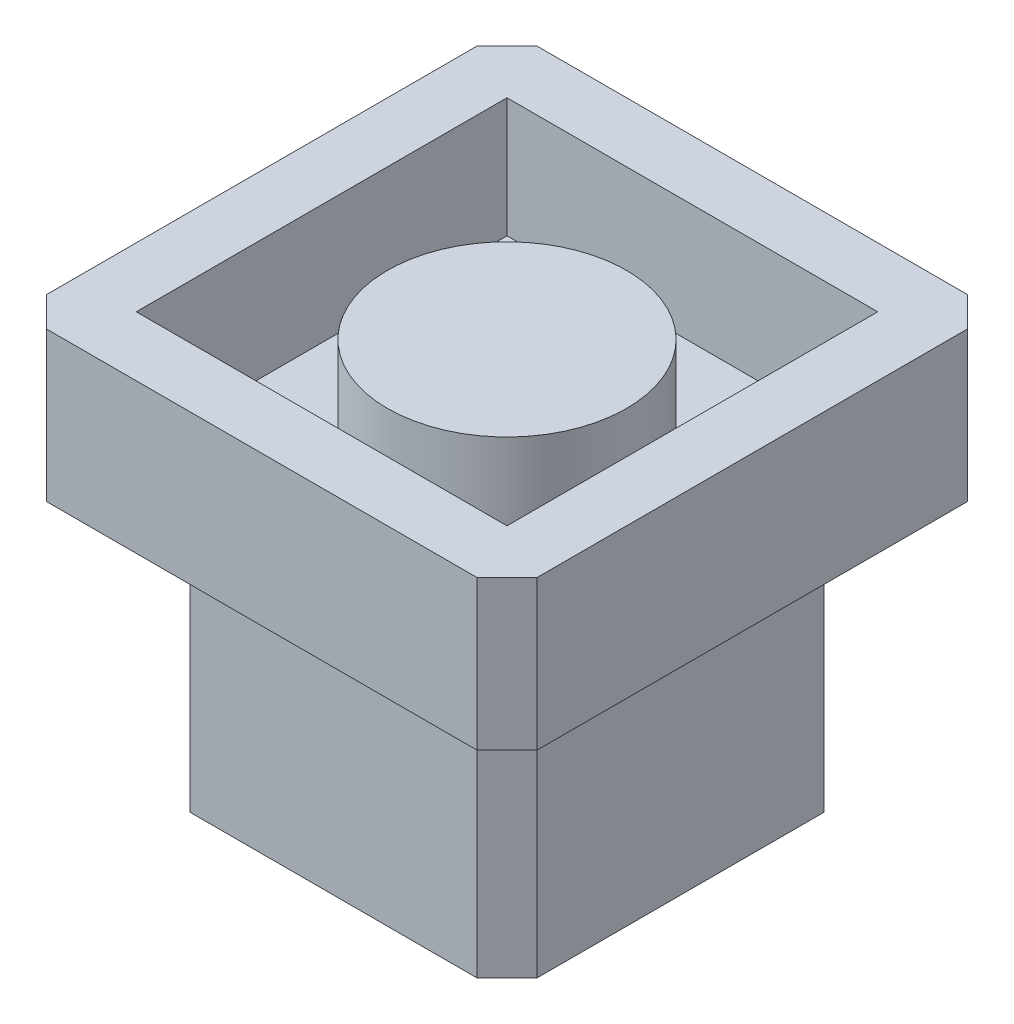
from build123d import *

# Parameters (mm, degrees)
SKETCH1_R           = 2
BOSS_EXTRUDE1_DEPTH = 1.6
SKETCH1_3_W         = 8.2
SKETCH1_3_H         = 8.2
SKETCH1_3_W_2       = 6.2
SKETCH1_3_H_2       = 6.2
BOSS_EXTRUDE2_DEPTH = 2
SKETCH1_4_W         = 8.2
SKETCH1_4_H         = 8.2
BOSS_EXTRUDE3_DEPTH = 0.5
SKETCH3_W           = 5.8
SKETCH3_H           = 5.8
BOSS_EXTRUDE4_DEPTH = 4.5
CHAMFER1_SIZE       = 0.5
CUT_EXTRUDE1_DEPTH  = 0.2


with BuildPart() as part:
    # Sketch1 → Boss-Extrude1 (new body)
    with BuildSketch(Plane(origin=(0, 0, 0), x_dir=(1, 0, 0), z_dir=(0, 1, 0))):
        Circle(SKETCH1_R)
    extrude(amount=BOSS_EXTRUDE1_DEPTH)



with BuildPart() as body_2:
    # Sketch1<3> → Boss-Extrude2 (new body)
    with BuildSketch(Plane(origin=(0, 0, 0), x_dir=(1, 0, 0), z_dir=(0, 1, 0))):
        Rectangle(SKETCH1_3_W, SKETCH1_3_H)
        Rectangle(SKETCH1_3_W_2, SKETCH1_3_H_2, mode=Mode.SUBTRACT)
    extrude(amount=BOSS_EXTRUDE2_DEPTH)


with BuildPart() as part_1:
    add(part.part)

    add(body_2.part)  # Boss-Extrude3 merges body 2
    # Sketch1<4> → Boss-Extrude3 (add)
    with BuildSketch(Plane(origin=(0, 0, 0), x_dir=(1, 0, 0), z_dir=(0, 1, 0))):
        Rectangle(SKETCH1_4_W, SKETCH1_4_H)
    extrude(amount=-BOSS_EXTRUDE3_DEPTH)

    # Sketch3 → Boss-Extrude4 (add)
    with BuildSketch(Plane.XZ.offset(0.5)):
        Rectangle(SKETCH3_W, SKETCH3_H)
    extrude(amount=BOSS_EXTRUDE4_DEPTH)

    # Chamfer1
    chamfer1_edges = [part_1.edges().sort_by_distance(p)[0] for p in [
        (-4.1, 0.75, -4.1),
        (4.1, 0.75, -4.1),
        (-4.1, 0.75, 4.1),
        (4.1, 0.75, 4.1),
        (-2.9, -2.75, 2.9),
        (2.9, -2.75, 2.9),
        (-2.9, -2.75, -2.9),
        (2.9, -2.75, -2.9),
    ]]
    chamfer(chamfer1_edges, length=CHAMFER1_SIZE)

    # Sketch4 → Cut-Extrude1 (cut)
    with BuildSketch(Plane.XZ.offset(5)):
        with BuildLine():
            Line((-0.866374082, 1.850562538), (-0.165953409, 1.850562538))
            add(Edge.make_bspline(
                [(-0.165953409, 1.850562538), (-0.11921228, 1.850406952), (-0.029464136, 1.85010821), (0.099109135, 1.848442447), (0.215936232, 1.843668091), (0.320956071, 1.839559508), (0.414166726, 1.832067567), (0.495854017, 1.824906919), (0.565641714, 1.815533259), (0.607887566, 1.806827836), (0.627015341, 1.802886256)],
                knots=[0, 0, 0, 0, 1.410062039, 2.707475311, 3.878576406, 4.937260626, 5.877586885, 6.699081471, 7.410979367, 8, 8, 8, 8], degree=3))
            add(Edge.make_bspline(
                [(0.627015341, 1.802886256), (0.652621966, 1.796559491), (0.703288955, 1.784040927), (0.776239021, 1.757581326), (0.845753345, 1.726961702), (0.911543169, 1.690997981), (0.973278961, 1.649423202), (1.031597271, 1.602955079), (1.086762735, 1.551847874), (1.136544365, 1.494813032), (1.183483417, 1.434976522), (1.223072043, 1.370272766), (1.257198523, 1.302611238), (1.28436904, 1.23130382), (1.306247013, 1.157042048), (1.321673253, 1.079153252), (1.33092444, 0.997992277), (1.331866296, 0.942634368), (1.332343867, 0.914564942)],
                knots=[0, 0, 0, 0, 1.027469482, 2.033020251, 3.019912614, 3.986113645, 4.951240523, 5.91722682, 6.890402269, 7.87763091, 8.8651537, 9.85103654, 10.82876324, 11.815024772, 12.821070561, 13.842952187, 14.906261191, 16, 16, 16, 16], degree=3))
            add(Edge.make_bspline(
                [(1.332343867, 0.914564942), (1.330874869, 0.867929837), (1.328008473, 0.77693267), (1.30128337, 0.644871788), (1.25750685, 0.521682474), (1.197183561, 0.407519836), (1.120364085, 0.30460919), (1.028039294, 0.214218735), (0.920157682, 0.138578822), (0.819728367, 0.086126018), (0.731014167, 0.052533109), (0.657980854, 0.02889675), (0.578313877, 0.010634785), (0.492776542, -0.005725347), (0.401012886, -0.018077041), (0.303242847, -0.027123636), (0.199396695, -0.032777684), (0.128057626, -0.033619689), (0.09135829, -0.034052846)],
                knots=[0, 0, 0, 0, 1.260483769, 2.459530307, 3.627416485, 4.787058657, 5.939039949, 7.08810263, 8.267026773, 9.491475466, 10.141966685, 10.831826277, 11.566392101, 12.351337768, 13.187381173, 14.07005841, 15.007169909, 16, 16, 16, 16], degree=3))
            Line((0.09135829, -0.034052846), (1.377215662, -1.649437462))
            Line((1.377215662, -1.649437462), (0.988794188, -1.649437462))
            Line((0.988794188, -1.649437462), (-0.297063184, -0.034052846))
            Line((-0.297063184, -0.034052846), (-0.552271517, -0.034052846))
            Line((-0.552271517, -0.034052846), (-0.552271517, -1.649437462))
            Line((-0.552271517, -1.649437462), (-0.866374082, -1.649437462))
            Line((-0.866374082, -1.649437462), (-0.866374082, 1.850562538))
        make_face()
        with BuildLine():
            Line((-0.552271517, 1.491588179), (-0.552271517, 0.324921513))
            Line((-0.552271517, 0.324921513), (0.088553803, 0.32001366))
            add(Edge.make_bspline(
                [(0.088553803, 0.32001366), (0.118473842, 0.320000423), (0.176467399, 0.319974767), (0.260368064, 0.323968543), (0.338488176, 0.328511861), (0.410528928, 0.335461207), (0.476522503, 0.344417279), (0.536435916, 0.355620263), (0.590366968, 0.368672326), (0.653265507, 0.388873951), (0.723502038, 0.42087997), (0.799833498, 0.467445468), (0.864835836, 0.526014588), (0.919753698, 0.592988044), (0.963883129, 0.666624292), (0.994995184, 0.746040662), (1.014737626, 0.82923226), (1.017066171, 0.886410367), (1.018241303, 0.915266064)],
                knots=[0, 0, 0, 0, 1.146690395, 2.22261258, 3.21895312, 4.145990853, 4.996080663, 5.770904154, 6.481378293, 7.121626537, 8.300444488, 9.431385265, 10.535395872, 11.636531494, 12.74115979, 13.810798291, 14.895190096, 16, 16, 16, 16], degree=3))
            add(Edge.make_bspline(
                [(1.018241303, 0.915266064), (1.017039182, 0.943412638), (1.014657017, 0.999188876), (0.995208248, 1.080844787), (0.962318867, 1.157911737), (0.917996629, 1.230076222), (0.863997474, 1.295581958), (0.800679661, 1.351629111), (0.729774466, 1.397878575), (0.663503268, 1.427432956), (0.604269055, 1.445552809), (0.552839395, 1.458303973), (0.494727917, 1.468548442), (0.429652459, 1.476756503), (0.357890828, 1.483811447), (0.279080177, 1.488563226), (0.193743397, 1.49137709), (0.134596465, 1.491516179), (0.103978483, 1.491588179)],
                knots=[0, 0, 0, 0, 1.101028733, 2.181837193, 3.264309656, 4.369019818, 5.486613113, 6.575447106, 7.666700264, 8.788928104, 9.402425223, 10.0903467, 10.862060571, 11.710948788, 12.657782767, 13.684531032, 14.801375019, 16, 16, 16, 16], degree=3))
            Line((0.103978483, 1.491588179), (-0.552271517, 1.491588179))
        make_face(mode=Mode.SUBTRACT)
    extrude(amount=-CUT_EXTRUDE1_DEPTH, mode=Mode.SUBTRACT)


solid = part_1.part
